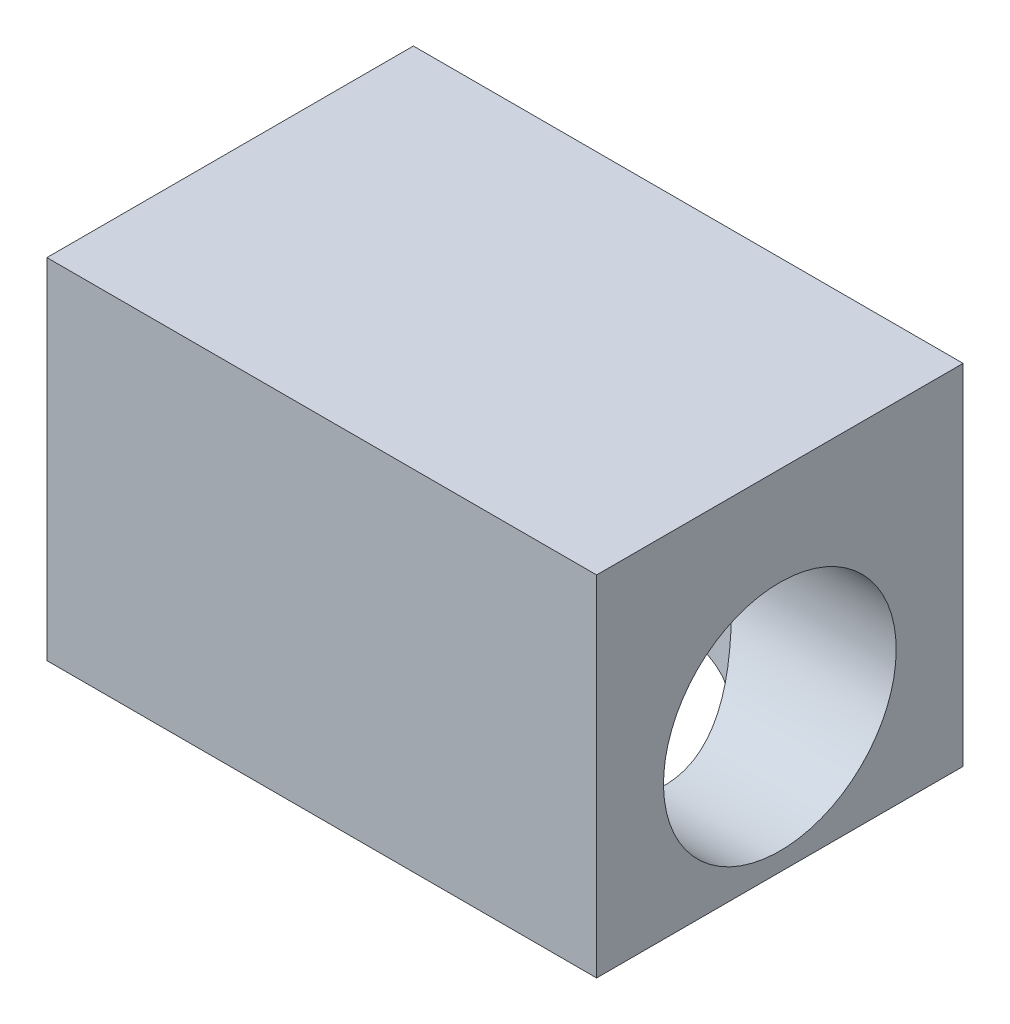
from build123d import *

# Parameters (mm, degrees)
SKETCH1_W           = 60
SKETCH1_H           = 40
BOSS_EXTRUDE1_DEPTH = 38.1


with BuildPart() as part:
    # Sketch1 → Boss-Extrude1 (new body)
    with BuildSketch(Plane(origin=(0, 0, 0), x_dir=(1, 0, 0), z_dir=(0, 1, 0))):
        Rectangle(SKETCH1_W, SKETCH1_H)
    extrude(amount=-BOSS_EXTRUDE1_DEPTH)

    # Sketch2 → Cut-Revolve1 (revolve, cut)
    with BuildSketch(Plane.XY, mode=Mode.PRIVATE) as cut_revolve1_sk:
        Polygon((62.630929862, -36.1), (62.630929862, -23.4), (5, -23.4), (12.630929862, -36.1), align=None)
        Polygon((-12.630929862, -36.1), (-5, -23.4), (-62.630929862, -23.4), (-62.630929862, -36.1), align=None)
    revolve(cut_revolve1_sk.sketch.rotate(Axis((-5, -23.4, 0), (-1, 0, 0)), 180), axis=Axis((-5, -23.4, 0), (-1, 0, 0)), mode=Mode.SUBTRACT)

    # Sketch4 → Cut-Revolve2 (revolve, cut)
    with BuildSketch(Plane.XY):
        Polygon((-17.5, -11), (-17.5, -38.1), (0, -38.1), (0, -2), (-11, -2), (-11, -3), (-13, -3), (-13, -11), align=None)
    revolve(axis=Axis((0, -2, 0), (0, -1, 0)), mode=Mode.SUBTRACT)


solid = part.part
